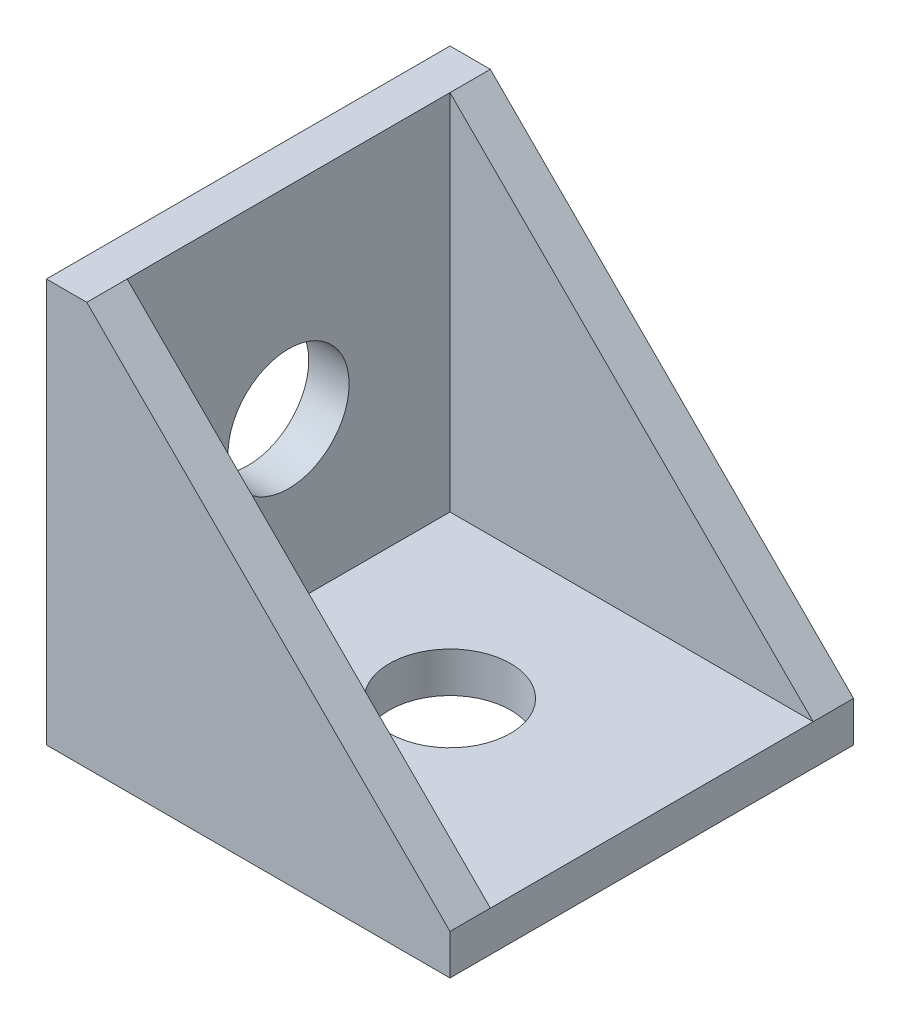
from build123d import *

# Parameters (mm, degrees)
BOSS_EXTRUDE1_DEPTH = 10
SKETCH2_W           = 18
SKETCH2_H           = 16
CUT_EXTRUDE1_DEPTH  = 18
SKETCH3_R           = 3
CUT_EXTRUDE2_DEPTH  = 20
SKETCH4_R           = 3
CUT_EXTRUDE3_DEPTH  = 20


with BuildPart() as part:
    # Sketch1 → Boss-Extrude1 (new, symmetric)
    with BuildSketch(Plane.XY):
        Polygon((20, 0), (0, 0), (0, 20), (2, 20), (20, 2), align=None)
    extrude(amount=BOSS_EXTRUDE1_DEPTH, both=True)

    # Sketch2 → Cut-Extrude1 (cut)
    with BuildSketch(Plane(origin=(0, 20, 0), x_dir=(1, 0, 0), z_dir=(0, 1, 0))):
        with Locations((11, 0)):
            Rectangle(SKETCH2_W, SKETCH2_H)
    extrude(amount=-CUT_EXTRUDE1_DEPTH, mode=Mode.SUBTRACT)

    # Sketch3 → Cut-Extrude2 (cut)
    with BuildSketch(Plane(origin=(2, 0, 0), x_dir=(0, 0, -1), z_dir=(1, 0, 0))):
        with Locations((0, 10)):
            Circle(SKETCH3_R)
    extrude(amount=-CUT_EXTRUDE2_DEPTH, mode=Mode.SUBTRACT)

    # Sketch4 → Cut-Extrude3 (cut)
    with BuildSketch(Plane(origin=(0, 2, 0), x_dir=(1, 0, 0), z_dir=(0, 1, 0))):
        with Locations(Location((10, 0, 0), (0, 0, 270))):
            Circle(SKETCH4_R)
    extrude(amount=-CUT_EXTRUDE3_DEPTH, mode=Mode.SUBTRACT)


solid = part.part
